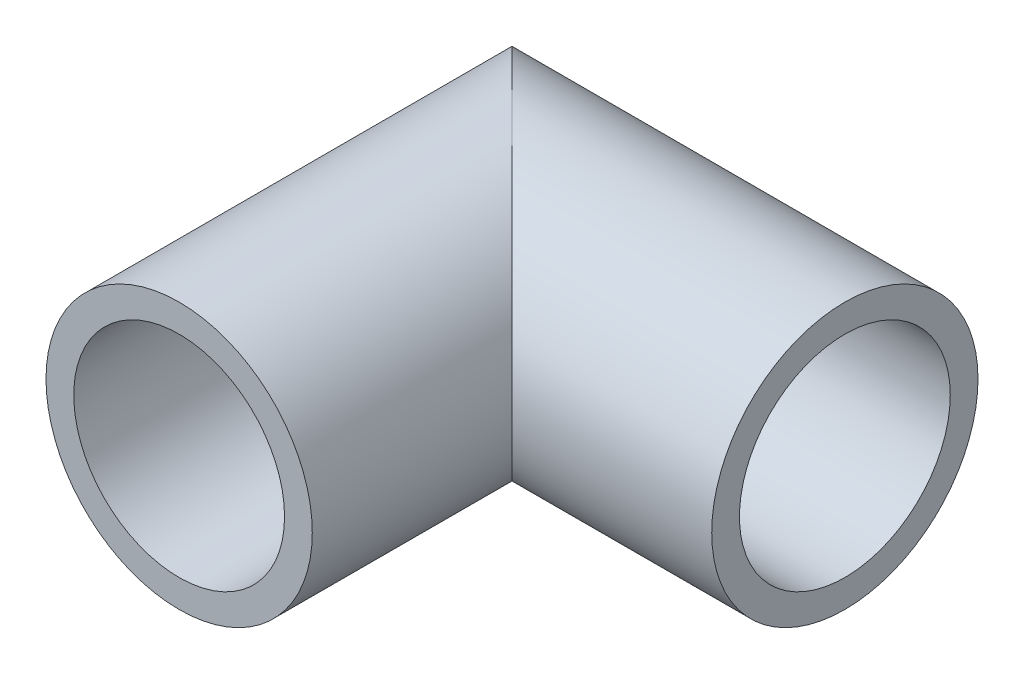
from build123d import *

# Parameters (mm, degrees)
SKETCH3_R   = 30.48
SKETCH3_R_2 = 24.13


with BuildPart() as part:
    # Sweep1: sweep along a path in Sketch2
    with BuildLine(Plane(origin=(0, 0, 0), x_dir=(1, 0, 0), z_dir=(0, 1, 0))) as sweep1_path:
        Line((0, 0), (0, 76.2))
        Line((0, 76.2), (76.2, 76.2))
    # Sketch3 → Sweep1 (sweep)
    with BuildSketch(Plane.XY):
        Circle(SKETCH3_R)
        Circle(SKETCH3_R_2, mode=Mode.SUBTRACT)
    sweep(path=sweep1_path.line, transition=Transition.RIGHT)


solid = part.part
